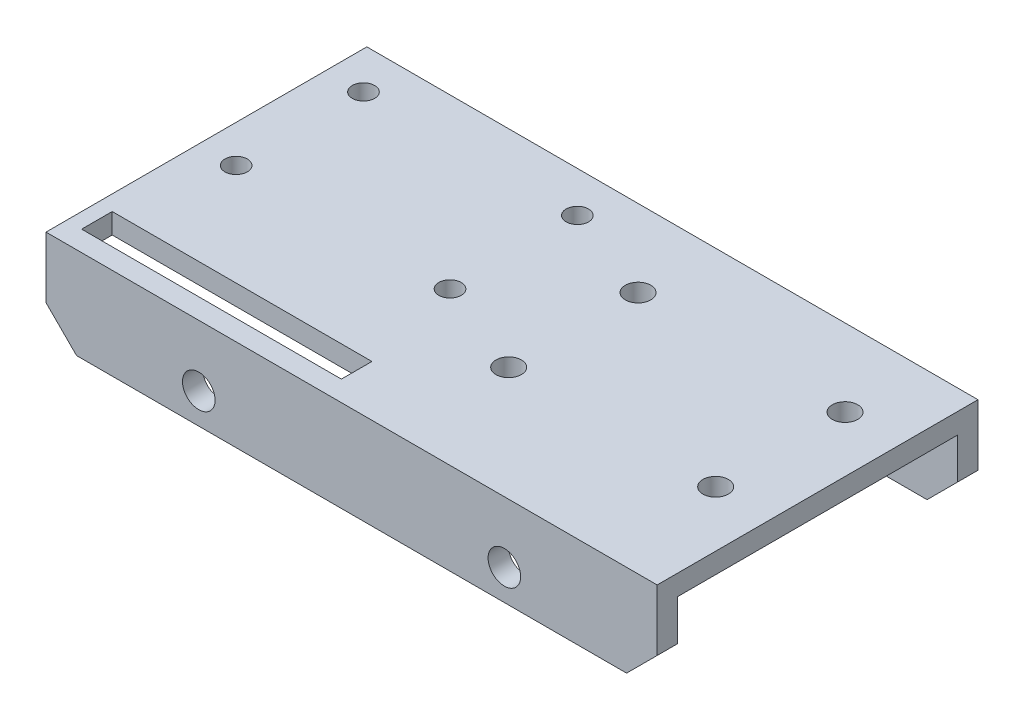
from build123d import *

# Parameters (mm, degrees)
SKETCH1_W               = 60
SKETCH1_H               = 31.5
BOSS_EXTRUDE1_DEPTH     = 2
SKETCH2_W               = 60
SKETCH2_H               = 2
BOSS_EXTRUDE2_DEPTH     = 7
CUT_EXTRUDE1_DEPTH      = 45.0596187
CUT_EXTRUDE1_DEPTH_BACK = 45.0596187
SKETCH3_R               = 1.6
CHAMFER1_SIZE           = 3
CHAMFER3_SIZE           = 3
SKETCH5_W               = 25.5
SKETCH5_H               = 3
CUT_EXTRUDE3_DEPTH      = 10
SKETCH6_R               = 1.25
SKETCH6_R_2             = 1.1
CUT_EXTRUDE4_DEPTH      = 10


with BuildPart() as part:
    # Sketch1 → Boss-Extrude1 (new body)
    with BuildSketch(Plane(origin=(0, 0, 0), x_dir=(1, 0, 0), z_dir=(0, 1, 0))):
        Rectangle(SKETCH1_W, SKETCH1_H)
    extrude(amount=BOSS_EXTRUDE1_DEPTH)

    # Sketch2 → Boss-Extrude2 (add)
    with BuildSketch(Plane.XZ):
        with Locations((0, -14.75)):
            Rectangle(SKETCH2_W, SKETCH2_H)
        with Locations((0, 14.75)):
            Rectangle(SKETCH2_W, SKETCH2_H)
    extrude(amount=BOSS_EXTRUDE2_DEPTH)

    # Sketch3 → Cut-Extrude1 (cut, two sides: drawn at the far end of the back side and taken through both)
    with BuildSketch(Plane(origin=(0, 0, -15.75), x_dir=(-1, 0, 0), z_dir=(0, 0, -1)).offset(-CUT_EXTRUDE1_DEPTH_BACK)):
        with Locations((15, -4)):
            Circle(SKETCH3_R)
        with Locations(Location((-15, -4, 0), (0, 0, 180))):
            Circle(SKETCH3_R)
    extrude(amount=CUT_EXTRUDE1_DEPTH + CUT_EXTRUDE1_DEPTH_BACK, mode=Mode.SUBTRACT)

    # Chamfer1
    chamfer1_edges = [part.edges().sort_by_distance(p)[0] for p in [
        (30, -7, -14.75),
        (-30, -7, -14.75),
    ]]
    chamfer(chamfer1_edges, length=CHAMFER1_SIZE)

    # Chamfer3
    chamfer3_edges = [part.edges().sort_by_distance(p)[0] for p in [
        (30, -7, 14.75),
        (-30, -7, 14.75),
    ]]
    chamfer(chamfer3_edges, length=CHAMFER3_SIZE)

    # Sketch5 → Cut-Extrude3 (cut)
    with BuildSketch(Plane.XZ):
        with Locations((-15.75, 12.25)):
            Rectangle(SKETCH5_W, SKETCH5_H)
    extrude(amount=-CUT_EXTRUDE3_DEPTH, mode=Mode.SUBTRACT)

    # Sketch6 → Cut-Extrude4 (cut)
    with BuildSketch(Plane(origin=(0, 2, 0), x_dir=(1, 0, 0), z_dir=(0, 1, 0))):
        with Locations(Location((24.525, 8.169, 0), (0, 0, 270))):
            Circle(SKETCH6_R)
        with Locations(Location((24.525, -4.531, 0), (0, 0, 270))):
            Circle(SKETCH6_R)
        with Locations(Location((4.205, -4.531, 0), (0, 0, 270))):
            Circle(SKETCH6_R)
        with Locations(Location((4.205, 8.169, 0), (0, 0, 270))):
            Circle(SKETCH6_R)
        with Locations(Location((-5.335, 11.75, 0), (0, 0, 270))):
            Circle(SKETCH6_R_2)
        with Locations(Location((-5.335, -0.75, 0), (0, 0, 270))):
            Circle(SKETCH6_R_2)
        with Locations(Location((-26.335, -0.75, 0), (0, 0, 270))):
            Circle(SKETCH6_R_2)
        with Locations(Location((-26.335, 11.75, 0), (0, 0, 270))):
            Circle(SKETCH6_R_2)
    extrude(amount=-CUT_EXTRUDE4_DEPTH, mode=Mode.SUBTRACT)


solid = part.part
